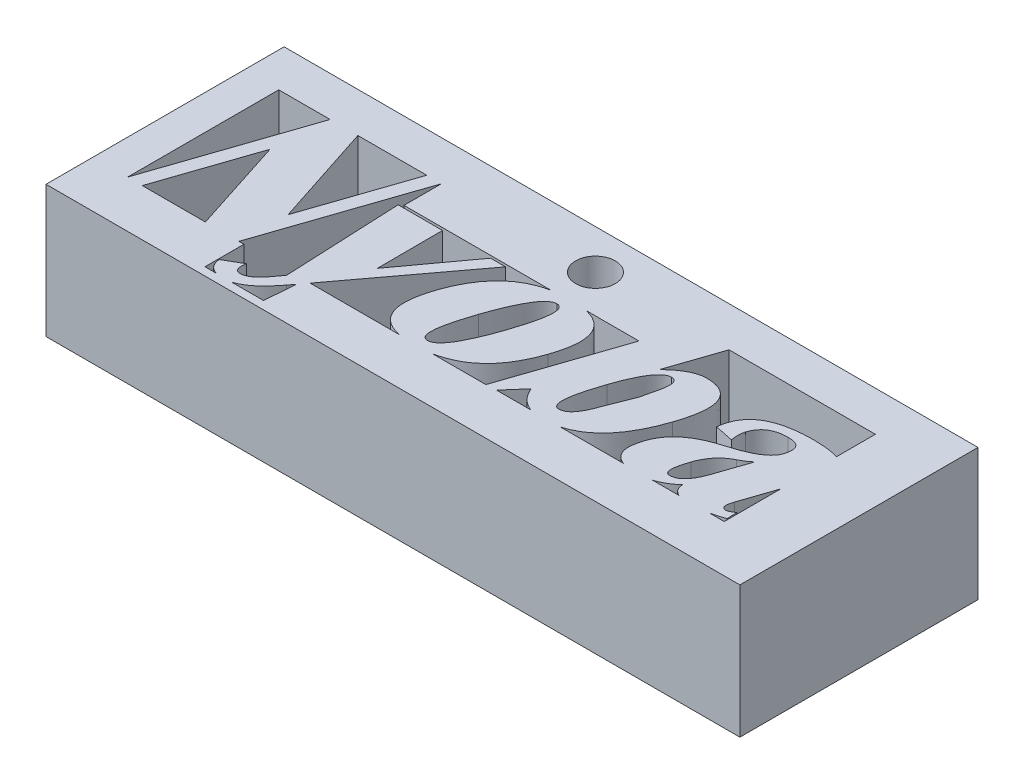
from build123d import *

# Parameters (mm, degrees)
BOSS_EXTRUDE1_DEPTH   = 10
BOSS_EXTRUDE1_2_DEPTH = 10
BOSS_EXTRUDE1_3_DEPTH = 10
BOSS_EXTRUDE1_4_DEPTH = 10
BOSS_EXTRUDE1_5_DEPTH = 10
BOSS_EXTRUDE5_DEPTH   = 10
SKETCH3_R             = 1.5
CUT_EXTRUDE1_DEPTH    = 10


with BuildPart() as part:
    # Sketch1 → Boss-Extrude1 (new body)
    with BuildSketch(Plane(origin=(0, 0, 0), x_dir=(1, 0, 0), z_dir=(0, 1, 0))):
        Polygon((13.285171, 11.459765625), (9.390641276, 0), (6.851487478, 0), (4.526209513, 7.22950058), (2.069124349, 0), (0.954980469, 0), (4.849510193, 11.459765625), (6.953451538, 11.459765625), (9.505039978, 3.615993754), (12.17102712, 11.459765625), align=None)
    extrude(amount=BOSS_EXTRUDE1_DEPTH)



with BuildPart() as body_2:
    # Sketch1 → Boss-Extrude1 2 (new body)
    with BuildSketch(Plane(origin=(0, 0, 0), x_dir=(1, 0, 0), z_dir=(0, 1, 0))):
        with BuildLine():
            Line((21.171220652, 8.435660807), (14.063579559, -1.069379171))
            add(Edge.make_bspline(
                [(14.063579559, -1.069379171), (13.944585095, -1.223575116), (13.716200832, -1.519521042), (13.355468809, -1.918598575), (12.997813379, -2.256674631), (12.643364074, -2.532918446), (12.292935081, -2.751837882), (11.943553034, -2.907427957), (11.596151624, -3.006426524), (11.364203668, -3.018301957), (11.250863647, -3.024104818)],
                knots=[0, 0, 0, 0, 1.318994485, 2.531526009, 3.639931488, 4.648586661, 5.571228885, 6.431032907, 7.233333353, 8, 8, 8, 8], degree=3))
            add(Edge.make_bspline(
                [(11.250863647, -3.024104818), (11.14784498, -3.020948248), (10.952904155, -3.014975114), (10.678503703, -2.965943828), (10.440166122, -2.88330152), (10.241347168, -2.760571884), (10.076626108, -2.607111034), (9.956540939, -2.414421713), (9.872061224, -2.190324674), (9.849904575, -2.027602414), (9.838288371, -1.942291005)],
                knots=[0, 0, 0, 0, 1.239523161, 2.345532834, 3.343160013, 4.257212786, 5.139605911, 6.028297907, 6.966283515, 8, 8, 8, 8], degree=3))
            Line((9.838288371, -1.942291005), (11.156360372, -1.17383016))
            add(Edge.make_bspline(
                [(11.156360372, -1.17383016), (11.144222307, -1.24327393), (11.121644149, -1.372447109), (11.109869304, -1.555262436), (11.122701432, -1.712103212), (11.16128016, -1.841979159), (11.225083509, -1.945792927), (11.317409458, -2.018673834), (11.433962461, -2.061477383), (11.519073609, -2.066474092), (11.564216614, -2.069124349)],
                knots=[0, 0, 0, 0, 1.454753201, 2.706003661, 3.772074978, 4.68687363, 5.479713085, 6.246827889, 7.070116434, 8, 8, 8, 8], degree=3))
            add(Edge.make_bspline(
                [(11.564216614, -2.069124349), (11.620100764, -2.065400664), (11.735581767, -2.057705909), (11.908430758, -2.004291301), (12.085915303, -1.921046953), (12.262719589, -1.798915491), (12.446500445, -1.649108824), (12.629019414, -1.462237524), (12.819550167, -1.246256651), (12.939071092, -1.08446918), (13.001661174, -0.999745178)],
                knots=[0, 0, 0, 0, 0.723576921, 1.495225197, 2.32647129, 3.255941294, 4.270912851, 5.394997918, 6.635826388, 8, 8, 8, 8], degree=3))
            Line((13.001661174, -0.999745178), (13.426925913, -0.420290883))
            Line((13.426925913, -0.420290883), (13.029017385, 8.435660807))
            Line((13.029017385, 8.435660807), (16.39383138, 8.435660807))
            Line((16.39383138, 8.435660807), (16.411239878, 3.474238841))
            Line((16.411239878, 3.474238841), (20.037181346, 8.435660807))
            Line((20.037181346, 8.435660807), (21.171220652, 8.435660807))
        make_face()
    extrude(amount=BOSS_EXTRUDE1_2_DEPTH)


with BuildPart() as body_3:
    # Sketch1 → Boss-Extrude1 3 (new body)
    with BuildSketch(Plane(origin=(0, 0, 0), x_dir=(1, 0, 0), z_dir=(0, 1, 0))):
        with BuildLine():
            add(Edge.make_bspline(
                [(25.819289653, 8.75398763), (25.987714429, 8.750933082), (26.310523729, 8.74507862), (26.771747319, 8.693187054), (27.188601337, 8.607184245), (27.561767138, 8.486673197), (27.891369278, 8.329880389), (28.176875534, 8.138134944), (28.414618908, 7.907264046), (28.60911591, 7.643045672), (28.756885343, 7.342300492), (28.858626831, 7.007215683), (28.914232479, 6.638066139), (28.925810252, 6.234865584), (28.887269196, 5.798015962), (28.809239481, 5.326673623), (28.686604439, 4.820578776), (28.575492276, 4.476608283), (28.517606862, 4.297412109)],
                knots=[0, 0, 0, 0, 1.229247068, 2.356021443, 3.382708377, 4.331935857, 5.211636368, 6.039164321, 6.8309341, 7.618924968, 8.422745332, 9.265012565, 10.165451544, 11.140262277, 12.202712173, 13.361787333, 14.625586715, 16, 16, 16, 16], degree=3))
            add(Edge.make_bspline(
                [(28.517606862, 4.297412109), (28.45351733, 4.116669773), (28.328005191, 3.762706238), (28.105802889, 3.25681793), (27.861242428, 2.787052257), (27.601641014, 2.347822068), (27.313841604, 1.948754053), (27.010917453, 1.578682939), (26.681273038, 1.249280477), (26.334580083, 0.95010375), (25.964765949, 0.688002055), (25.573195287, 0.461469795), (25.160625961, 0.268674102), (24.726740719, 0.112363787), (24.272501677, -0.00970624), (23.797608217, -0.096242314), (23.301258468, -0.14966953), (22.962774779, -0.155957642), (22.790210978, -0.159163411)],
                knots=[0, 0, 0, 0, 1.175065552, 2.301233694, 3.382913599, 4.419814754, 5.425063526, 6.395650903, 7.347709817, 8.277394233, 9.199369194, 10.121358154, 11.046477625, 11.986695364, 12.944323502, 13.925912684, 14.942600774, 16, 16, 16, 16], degree=3))
            add(Edge.make_bspline(
                [(22.790210978, -0.159163411), (22.621776627, -0.156153752), (22.298948977, -0.150385326), (21.836235766, -0.097723237), (21.417403501, -0.013153176), (21.042814833, 0.108260851), (20.71301466, 0.264782143), (20.427634055, 0.457528581), (20.187367342, 0.686649743), (19.993038121, 0.951894663), (19.84511143, 1.252491579), (19.743468743, 1.587614643), (19.687611571, 1.956770074), (19.677047133, 2.359832717), (19.711289454, 2.796948475), (19.790618432, 3.268127139), (19.912861416, 3.774252139), (20.02403082, 4.118218229), (20.081946055, 4.297412109)],
                knots=[0, 0, 0, 0, 1.228038986, 2.353705987, 3.391218502, 4.339513098, 5.218349054, 6.045063728, 6.840410309, 7.627626754, 8.430657137, 9.272096605, 10.171650648, 11.145503354, 12.206444081, 13.364380122, 14.626937465, 16, 16, 16, 16], degree=3))
            add(Edge.make_bspline(
                [(20.081946055, 4.297412109), (20.146011962, 4.478169568), (20.271477832, 4.832162718), (20.494011727, 5.337838783), (20.73758412, 5.808743214), (21.001368184, 6.245236923), (21.284871047, 6.648002895), (21.591647563, 7.014187961), (21.918219088, 7.347309182), (22.267725548, 7.644596811), (22.639338813, 7.906200308), (23.031284283, 8.133440896), (23.443925156, 8.326086208), (23.878489531, 8.482904534), (24.334556311, 8.604478377), (24.811095428, 8.690864321), (25.308238261, 8.744524177), (25.646724534, 8.750792136), (25.819289653, 8.75398763)],
                knots=[0, 0, 0, 0, 1.17379807, 2.298751473, 3.379264627, 4.417667667, 5.418890693, 6.391680266, 7.339143885, 8.271686748, 9.196811248, 10.117805706, 11.0419273, 11.981130875, 12.942627758, 13.928149894, 14.943741336, 16, 16, 16, 16], degree=3))
        make_face()
        with BuildLine():
            add(Edge.make_bspline(
                [(25.540753682, 7.958170573), (25.497357686, 7.954910296), (25.407817705, 7.94818329), (25.273951762, 7.90356534), (25.14128753, 7.828546778), (25.005635914, 7.72774268), (24.870046914, 7.596565012), (24.729774326, 7.439675177), (24.592257658, 7.251296646), (24.449330289, 7.03745884), (24.309401808, 6.792595015), (24.164335746, 6.520937306), (24.018977496, 6.219990197), (23.868658836, 5.891594233), (23.721076273, 5.533115483), (23.568893669, 5.146944042), (23.414682028, 4.732654231), (23.315965899, 4.445198113), (23.265214284, 4.297412109)],
                knots=[0, 0, 0, 0, 0.465798473, 0.96109295, 1.498705268, 2.096703288, 2.770241422, 3.520316646, 4.353229604, 5.271341494, 6.280187857, 7.378906499, 8.576821054, 9.867090618, 11.255275713, 12.73753087, 14.322709995, 16, 16, 16, 16], degree=3))
            add(Edge.make_bspline(
                [(23.265214284, 4.297412109), (23.215812116, 4.150018223), (23.120331088, 3.865145707), (22.990376609, 3.45097652), (22.881774599, 3.063873801), (22.785733677, 2.70731335), (22.710557657, 2.377871037), (22.654591553, 2.077296893), (22.608269554, 1.805941203), (22.590152335, 1.562071404), (22.583404387, 1.347064288), (22.593067124, 1.159723356), (22.626364882, 1.001358824), (22.670370555, 0.868255084), (22.739653915, 0.76488109), (22.826410147, 0.688793529), (22.934083261, 0.644689676), (23.01114871, 0.639408031), (23.05133845, 0.636653646)],
                knots=[0, 0, 0, 0, 1.867939927, 3.610222641, 5.215197755, 6.698700538, 8.047097408, 9.273972599, 10.372859214, 11.352294881, 12.209181684, 12.957923034, 13.598694019, 14.150165215, 14.630885378, 15.076025384, 15.51814594, 16, 16, 16, 16], degree=3))
            add(Edge.make_bspline(
                [(23.05133845, 0.636653646), (23.095589541, 0.639812799), (23.186017402, 0.646268582), (23.321124279, 0.691873659), (23.45540413, 0.765442552), (23.591369412, 0.867203482), (23.727009257, 0.998239868), (23.867421756, 1.155071067), (24.004484665, 1.344291631), (24.150828062, 1.556425684), (24.289531442, 1.803037912), (24.43820978, 2.073148151), (24.583358651, 2.374351059), (24.730276521, 2.703874665), (24.878698282, 3.061610972), (25.030593921, 3.447908992), (25.184888816, 3.862162081), (25.283593105, 4.149623421), (25.334338633, 4.297412109)],
                knots=[0, 0, 0, 0, 0.47398303, 0.968592427, 1.513273463, 2.110444346, 2.783050859, 3.532088596, 4.363849489, 5.285630575, 6.293081526, 7.394482706, 8.590740334, 9.875573513, 11.261838504, 12.74204344, 14.325029983, 16, 16, 16, 16], degree=3))
            add(Edge.make_bspline(
                [(25.334338633, 4.297412109), (25.383851491, 4.444774414), (25.479546452, 4.729585891), (25.608085813, 5.144396675), (25.721692994, 5.530092045), (25.813451105, 5.887873296), (25.887544759, 6.217343981), (25.950416963, 6.516664999), (25.986227244, 6.789560678), (26.010063559, 7.032502017), (26.017384744, 7.248015786), (26.002035258, 7.434545576), (25.974675358, 7.594258711), (25.926498359, 7.726949268), (25.854904404, 7.829294652), (25.768265694, 7.906114064), (25.659688333, 7.950435497), (25.58177844, 7.955502472), (25.540753682, 7.958170573)],
                knots=[0, 0, 0, 0, 1.865850032, 3.606183439, 5.212108544, 6.691444057, 8.03833231, 9.265731815, 10.360498967, 11.339698587, 12.195626685, 12.944258019, 13.5823757, 14.136723438, 14.622542498, 15.06718447, 15.508810371, 16, 16, 16, 16], degree=3))
        make_face(mode=Mode.SUBTRACT)
    extrude(amount=BOSS_EXTRUDE1_3_DEPTH)


with BuildPart() as body_4:
    # Sketch1 → Boss-Extrude1 4 (new body)
    with BuildSketch(Plane(origin=(0, 0, 0), x_dir=(1, 0, 0), z_dir=(0, 1, 0))):
        with BuildLine():
            Line((28.171923828, 0), (32.066453552, 11.459765625))
            add(Edge.make_bspline(
                [(32.066453552, 11.459765625), (32.136090434, 11.460390761), (32.292802768, 11.461797582), (32.553180429, 11.469282739), (32.863980195, 11.485348887), (33.224595963, 11.505086258), (33.634935154, 11.530136968), (34.095003051, 11.560210754), (34.605759647, 11.59443167), (34.962919535, 11.621920203), (35.150244649, 11.636337535)],
                knots=[0, 0, 0, 0, 0.541004987, 1.217489252, 2.023425992, 2.958657658, 4.023220479, 5.217138913, 6.540430244, 8, 8, 8, 8], degree=3))
            Line((35.150244649, 11.636337535), (33.757564799, 7.540366618))
            add(Edge.make_bspline(
                [(33.757564799, 7.540366618), (33.861922473, 7.63589343), (34.063690028, 7.820587189), (34.370124929, 8.070830642), (34.673838676, 8.277300894), (34.966458674, 8.452738951), (35.256973232, 8.583647312), (35.537765292, 8.684449269), (35.814541486, 8.740348359), (35.996414861, 8.749509099), (36.085329692, 8.75398763)],
                knots=[0, 0, 0, 0, 1.264227509, 2.444286863, 3.531248669, 4.54385076, 5.488605986, 6.374146394, 7.205147542, 8, 8, 8, 8], degree=3))
            add(Edge.make_bspline(
                [(36.085329692, 8.75398763), (36.205666099, 8.750440349), (36.435729983, 8.743658517), (36.763644744, 8.69844916), (37.056374931, 8.615800709), (37.315470703, 8.50192193), (37.541721069, 8.353961489), (37.73000419, 8.169507898), (37.884765167, 7.953269178), (38.004903031, 7.704602238), (38.085276104, 7.422710944), (38.131956309, 7.110194033), (38.142653476, 6.764960906), (38.117988511, 6.387532479), (38.06330265, 5.976660075), (37.968328122, 5.535734294), (37.844824893, 5.060193307), (37.737766314, 4.737016671), (37.681937663, 4.568487295)],
                knots=[0, 0, 0, 0, 1.04276418, 1.993597636, 2.859899959, 3.670191886, 4.43720561, 5.188999834, 5.94051948, 6.730824996, 7.569528261, 8.470629504, 9.462549342, 10.556294558, 11.744877076, 13.050801542, 14.46205906, 16, 16, 16, 16], degree=3))
            add(Edge.make_bspline(
                [(37.681937663, 4.568487295), (37.614051057, 4.377163167), (37.481288516, 4.002999855), (37.257682118, 3.466568061), (37.018812731, 2.966247368), (36.763262799, 2.504884483), (36.494240793, 2.07840608), (36.207544351, 1.690106072), (35.907895199, 1.335824324), (35.590646705, 1.019632252), (35.255800192, 0.744345664), (34.910119486, 0.499128444), (34.544097654, 0.298524923), (34.165285626, 0.130335361), (33.769611581, -8.1965e-05), (33.358645776, -0.089964265), (32.93290082, -0.151078697), (32.643640675, -0.15643986), (32.496692149, -0.159163411)],
                knots=[0, 0, 0, 0, 1.290986424, 2.524719497, 3.694376449, 4.815358314, 5.877239036, 6.899057916, 7.882675239, 8.825897986, 9.743304395, 10.636966131, 11.517261398, 12.393061135, 13.270050311, 14.161594361, 15.066062145, 16, 16, 16, 16], degree=3))
            add(Edge.make_bspline(
                [(32.496692149, -0.159163411), (32.361220487, -0.15454901), (32.099011418, -0.14561771), (31.72105368, -0.072104679), (31.374200795, 0.048473718), (31.061275107, 0.223988912), (30.779489447, 0.444853987), (30.530938633, 0.715485585), (30.314184838, 1.034698059), (30.20367204, 1.273968277), (30.146544902, 1.397653707)],
                knots=[0, 0, 0, 0, 1.079581468, 2.089559167, 3.05764771, 3.995748367, 4.937359693, 5.901036756, 6.91498753, 8, 8, 8, 8], degree=3))
            Line((30.146544902, 1.397653707), (28.925463104, 0))
            Line((28.925463104, 0), (28.171923828, 0))
        make_face()
        with BuildLine():
            add(Edge.make_bspline(
                [(34.720006053, 7.480680339), (34.679241017, 7.477717952), (34.595718046, 7.471648356), (34.470204849, 7.439443258), (34.346970132, 7.378690869), (34.221474278, 7.300101368), (34.101211599, 7.191950648), (33.974651885, 7.068917971), (33.854584346, 6.916717919), (33.729873875, 6.745729185), (33.60562772, 6.551674764), (33.484122158, 6.333042404), (33.360704512, 6.093263533), (33.235599126, 5.830667807), (33.111504911, 5.545531654), (32.990518326, 5.23519784), (32.866207421, 4.903839664), (32.786341178, 4.67394494), (32.745384979, 4.556052653)],
                knots=[0, 0, 0, 0, 0.531561073, 1.08910881, 1.673281945, 2.313939159, 3.010429782, 3.773549671, 4.609575287, 5.529190165, 6.529081087, 7.606675547, 8.78440468, 10.039499126, 11.392827221, 12.831748407, 14.375289259, 16, 16, 16, 16], degree=3))
            add(Edge.make_bspline(
                [(32.745384979, 4.556052653), (32.698218901, 4.417026331), (32.607580901, 4.149862547), (32.488392466, 3.759557473), (32.384103598, 3.397205314), (32.293058116, 3.061129042), (32.2214433, 2.7516245), (32.165051394, 2.469008998), (32.128244427, 2.213186056), (32.10431512, 1.984312274), (32.097718748, 1.78202201), (32.110767812, 1.606633186), (32.133562829, 1.45577722), (32.183396692, 1.334519372), (32.241245396, 1.233639147), (32.325105492, 1.16546403), (32.423407772, 1.118699635), (32.496116074, 1.115704371), (32.533996073, 1.11414388)],
                knots=[0, 0, 0, 0, 1.877099092, 3.607179479, 5.217517603, 6.698501046, 8.058671159, 9.278942107, 10.382242031, 11.362082124, 12.220930577, 12.964809562, 13.611399598, 14.158601728, 14.635005133, 15.078808028, 15.520071984, 16, 16, 16, 16], degree=3))
            add(Edge.make_bspline(
                [(32.533996073, 1.11414388), (32.602779308, 1.119578696), (32.743508729, 1.130698243), (32.946027834, 1.219685822), (33.138729587, 1.358455992), (33.3205528, 1.552499907), (33.494007327, 1.799462944), (33.659367475, 2.100431002), (33.817846247, 2.454317695), (33.910245202, 2.711704636), (33.959005992, 2.847532908)],
                knots=[0, 0, 0, 0, 0.692664402, 1.417180531, 2.197722036, 3.079979668, 4.08825708, 5.238900149, 6.542912008, 8, 8, 8, 8], degree=3))
            Line((33.959005992, 2.847532908), (34.777205404, 4.914170329))
            Line((34.777205404, 4.914170329), (35.048280589, 6.075565847))
            add(Edge.make_bspline(
                [(35.048280589, 6.075565847), (35.074446922, 6.184583775), (35.123067279, 6.387152873), (35.15994574, 6.673848596), (35.171305809, 6.917518646), (35.149578071, 7.119466346), (35.094707395, 7.281458469), (35.001363414, 7.399630475), (34.870191459, 7.470482237), (34.772311018, 7.477128653), (34.720006053, 7.480680339)],
                knots=[0, 0, 0, 0, 1.616096948, 3.002912534, 4.163390542, 5.127473154, 5.91823792, 6.598056841, 7.250835133, 8, 8, 8, 8], degree=3))
        make_face(mode=Mode.SUBTRACT)
    extrude(amount=BOSS_EXTRUDE1_4_DEPTH)


with BuildPart() as body_5:
    # Sketch1 → Boss-Extrude1 5 (new body)
    with BuildSketch(Plane(origin=(0, 0, 0), x_dir=(1, 0, 0), z_dir=(0, 1, 0))):
        with BuildLine():
            add(Edge.make_bspline(
                [(46.1026769, 0.303405253), (45.896432798, 0.23288838), (45.497174634, 0.096378113), (44.899746942, -0.047157294), (44.329091915, -0.140048966), (43.955954387, -0.152919005), (43.774912008, -0.159163411)],
                knots=[0, 0, 0, 0, 1.096438446, 2.122543122, 3.089077793, 4, 4, 4, 4], degree=3))
            add(Edge.make_bspline(
                [(43.774912008, -0.159163411), (43.652056536, -0.156913147), (43.421871648, -0.152696999), (43.099942921, -0.106330779), (42.826078685, -0.028662609), (42.597633781, 0.080159699), (42.418011706, 0.224659529), (42.285442403, 0.401619501), (42.206011411, 0.613970695), (42.194343202, 0.766123453), (42.18825175, 0.845555623)],
                knots=[0, 0, 0, 0, 1.394250094, 2.612299619, 3.681604072, 4.616137303, 5.465854739, 6.273499309, 7.098670974, 8, 8, 8, 8], degree=3))
            add(Edge.make_bspline(
                [(42.18825175, 0.845555623), (42.096916581, 0.764923687), (41.916727523, 0.605850322), (41.624395483, 0.403204014), (41.324123354, 0.230068471), (41.014371822, 0.086269171), (40.692787938, -0.021861378), (40.361978391, -0.102952794), (40.021080445, -0.151121904), (39.790173984, -0.156471271), (39.673967234, -0.159163411)],
                knots=[0, 0, 0, 0, 1.05354736, 2.078473278, 3.071470751, 4.05048091, 5.028228712, 6.002575825, 6.994769703, 8, 8, 8, 8], degree=3))
            add(Edge.make_bspline(
                [(39.673967234, -0.159163411), (39.56860518, -0.157451377), (39.365716455, -0.154154625), (39.075658001, -0.123797464), (38.811599184, -0.077640066), (38.574962617, -0.012033425), (38.365258732, 0.075872409), (38.181822637, 0.182433846), (38.025767288, 0.309549674), (37.898772929, 0.457420937), (37.797754602, 0.623369399), (37.725465188, 0.81031883), (37.681188097, 1.01668736), (37.664827022, 1.241618715), (37.67590621, 1.485093693), (37.714667278, 1.747100341), (37.77962433, 2.029022686), (37.841265858, 2.220427035), (37.873431142, 2.320304108)],
                knots=[0, 0, 0, 0, 1.304620715, 2.512221632, 3.607818634, 4.621862217, 5.546736593, 6.416631869, 7.240915559, 8.027168397, 8.819564973, 9.635622329, 10.497604322, 11.424471289, 12.421266459, 13.510300629, 14.700845172, 16, 16, 16, 16], degree=3))
            add(Edge.make_bspline(
                [(37.873431142, 2.320304108), (37.901069235, 2.397962432), (37.956079629, 2.552532254), (38.062981953, 2.774040182), (38.181831725, 2.989320466), (38.318870884, 3.19506343), (38.470850198, 3.392101647), (38.638831505, 3.579829924), (38.822474219, 3.758500452), (39.022784193, 3.927603829), (39.236264718, 4.089735332), (39.466874238, 4.24165734), (39.712883964, 4.386307458), (39.976563962, 4.519893258), (40.255957162, 4.64393621), (40.549783261, 4.760453108), (40.858508994, 4.871417655), (41.072102985, 4.93431518), (41.181045787, 4.966395823)],
                knots=[0, 0, 0, 0, 0.895932749, 1.783249465, 2.671253047, 3.568998693, 4.468914995, 5.375670759, 6.306580238, 7.253249886, 8.225214829, 9.220486441, 10.255007372, 11.327607293, 12.433493681, 13.578707072, 14.765028765, 16, 16, 16, 16], degree=3))
            add(Edge.make_bspline(
                [(41.181045787, 4.966395823), (41.374882617, 5.024840013), (41.743030599, 5.135841161), (42.256670283, 5.325806803), (42.707210243, 5.518811311), (43.089140544, 5.727388377), (43.407008405, 5.943121505), (43.659728767, 6.167634136), (43.854429759, 6.401561275), (43.928607596, 6.576647499), (43.963918559, 6.659993998)],
                knots=[0, 0, 0, 0, 1.44603237, 2.746402208, 3.910564404, 4.944253428, 5.851059526, 6.647821504, 7.356320889, 8, 8, 8, 8], degree=3))
            add(Edge.make_bspline(
                [(43.963918559, 6.659993998), (43.99416091, 6.760341091), (44.049929889, 6.94538804), (44.086510964, 7.213696632), (44.057683488, 7.445200573), (43.975569283, 7.641406888), (43.826240776, 7.789488462), (43.622552334, 7.889423545), (43.367991202, 7.949898362), (43.180086131, 7.955269086), (43.078572083, 7.958170573)],
                knots=[0, 0, 0, 0, 1.26721943, 2.336839907, 3.247230097, 4.059641373, 4.860837845, 5.730853818, 6.774113896, 8, 8, 8, 8], degree=3))
            add(Edge.make_bspline(
                [(43.078572083, 7.958170573), (42.955616289, 7.954760405), (42.720545534, 7.948240738), (42.38478127, 7.887715192), (42.083830524, 7.788604262), (41.814457267, 7.651592193), (41.581991207, 7.469399203), (41.387160278, 7.246075136), (41.220056572, 6.987072484), (41.146764872, 6.791044865), (41.108924866, 6.689837138)],
                knots=[0, 0, 0, 0, 1.167645444, 2.23234131, 3.228837679, 4.169623404, 5.089967512, 6.016360831, 6.975860583, 8, 8, 8, 8], degree=3))
            add(Edge.make_bspline(
                [(41.108924866, 6.689837138), (41.089097176, 6.618994279), (41.047023803, 6.468669253), (41.032021909, 6.218941194), (41.045110397, 5.939098609), (41.075451775, 5.743771558), (41.091516368, 5.640353394)],
                knots=[0, 0, 0, 0, 0.831019779, 1.763382674, 2.815797118, 4, 4, 4, 4], degree=3))
            Line((41.091516368, 5.640353394), (39.671480306, 5.933810933))
            add(Edge.make_bspline(
                [(39.671480306, 5.933810933), (39.689691274, 6.064689717), (39.725335821, 6.320860325), (39.799395391, 6.568646231), (39.835617574, 6.689837138)],
                knots=[0, 0, 0, 0, 1.02180952, 2, 2, 2, 2], degree=3))
            add(Edge.make_bspline(
                [(39.835617574, 6.689837138), (39.86701501, 6.774309568), (39.929050416, 6.941211138), (40.052202942, 7.176840206), (40.200505251, 7.394248758), (40.3706297, 7.59652297), (40.562650227, 7.784693476), (40.779975695, 7.952825408), (41.019909765, 8.106236259), (41.281374515, 8.2448214), (41.568388907, 8.364093348), (41.877603829, 8.468258572), (42.209804176, 8.557384655), (42.565485102, 8.628792017), (42.943005831, 8.686361325), (43.344881981, 8.724565826), (43.769590046, 8.750713041), (44.060866195, 8.752878161), (44.210124461, 8.75398763)],
                knots=[0, 0, 0, 0, 0.835094197, 1.649988442, 2.458073729, 3.271080298, 4.09738884, 4.946239611, 5.81412628, 6.735709725, 7.686581105, 8.693006228, 9.759636701, 10.873770639, 12.055547515, 13.29930583, 14.616086723, 16, 16, 16, 16], degree=3))
            add(Edge.make_bspline(
                [(44.210124461, 8.75398763), (44.350239473, 8.752555425), (44.619886075, 8.749799195), (45.007700115, 8.728965373), (45.36251785, 8.687483623), (45.686489873, 8.638576324), (45.977458634, 8.56741499), (46.238106508, 8.488684616), (46.464096389, 8.387416027), (46.660071045, 8.275236531), (46.821721615, 8.143275437), (46.955405578, 7.999082658), (47.049213758, 7.833761981), (47.117435537, 7.656512551), (47.145433588, 7.462527066), (47.14089572, 7.254998964), (47.109671031, 7.031821933), (47.062466892, 6.882424886), (47.037761943, 6.80423584)],
                knots=[0, 0, 0, 0, 1.612375176, 3.102961509, 4.466096455, 5.722265399, 6.869864671, 7.910684801, 8.850184943, 9.713994311, 10.500615135, 11.24369205, 11.961923158, 12.67423861, 13.417621608, 14.199892422, 15.057888384, 16, 16, 16, 16], degree=3))
            Line((47.037761943, 6.80423584), (45.29691213, 1.681163534))
            add(Edge.make_bspline(
                [(45.29691213, 1.681163534), (45.274837749, 1.612716199), (45.23378513, 1.485421925), (45.196471687, 1.304678684), (45.179795995, 1.150493838), (45.194261369, 1.023402443), (45.229537397, 0.919426397), (45.29914011, 0.843246197), (45.398020412, 0.804139921), (45.469861956, 0.798718049), (45.508301036, 0.795817057)],
                knots=[0, 0, 0, 0, 1.577969068, 2.934612848, 4.048770832, 4.965492539, 5.726142785, 6.421710344, 7.155530393, 8, 8, 8, 8], degree=3))
            add(Edge.make_bspline(
                [(45.508301036, 0.795817057), (45.540153774, 0.80034743), (45.61747353, 0.811344518), (45.742182023, 0.870083125), (45.898816327, 0.955237643), (46.008850668, 1.030053112), (46.070346832, 1.071866099)],
                knots=[0, 0, 0, 0, 0.608272766, 1.476529326, 2.589678762, 4, 4, 4, 4], degree=3))
            Line((46.070346832, 1.071866099), (46.1026769, 0.303405253))
        make_face()
        with BuildLine():
            add(Edge.make_bspline(
                [(43.424255117, 5.070846812), (43.2920952, 4.965175823), (43.029422768, 4.755151058), (42.731633942, 4.598880764), (42.58367335, 4.521235657)],
                knots=[0, 0, 0, 0, 1.006271696, 2, 2, 2, 2], degree=3))
            add(Edge.make_bspline(
                [(42.58367335, 4.521235657), (42.492203045, 4.472543052), (42.311343936, 4.376265892), (42.060682766, 4.199616131), (41.831673004, 3.999595739), (41.619922781, 3.77761273), (41.435037166, 3.527940739), (41.269536144, 3.256619982), (41.123582869, 2.962601306), (41.048015667, 2.75304494), (41.009447734, 2.646091715)],
                knots=[0, 0, 0, 0, 0.988015722, 1.953548124, 2.917913406, 3.885937426, 4.874681131, 5.875844555, 6.915875102, 8, 8, 8, 8], degree=3))
            add(Edge.make_bspline(
                [(41.009447734, 2.646091715), (40.966552191, 2.514728809), (40.887016738, 2.27116019), (40.797620266, 1.927832297), (40.747898767, 1.635588516), (40.73426873, 1.395523211), (40.755798152, 1.203915564), (40.822594995, 1.059806384), (40.939535793, 0.967836607), (41.032752733, 0.959399054), (41.081568654, 0.954980469)],
                knots=[0, 0, 0, 0, 1.734384893, 3.215837308, 4.449253675, 5.449068203, 6.22755132, 6.84649404, 7.395931074, 8, 8, 8, 8], degree=3))
            add(Edge.make_bspline(
                [(41.081568654, 0.954980469), (41.159373658, 0.960330155), (41.314974794, 0.971028916), (41.539391281, 1.056356088), (41.75017004, 1.19247144), (41.946984195, 1.383083673), (42.130616176, 1.626108797), (42.304730848, 1.919657654), (42.465548839, 2.266784004), (42.555942537, 2.520091136), (42.603568776, 2.6535525)],
                knots=[0, 0, 0, 0, 0.76715715, 1.534226819, 2.340952032, 3.233305082, 4.22624964, 5.343145173, 6.600167843, 8, 8, 8, 8], degree=3))
            Line((42.603568776, 2.6535525), (43.424255117, 5.070846812))
        make_face(mode=Mode.SUBTRACT)
    extrude(amount=BOSS_EXTRUDE1_5_DEPTH)


with BuildPart() as part_1:
    add(part.part)

    add(body_2.part)  # Boss-Extrude5 merges body 2

    add(body_3.part)  # Boss-Extrude5 merges body 3

    add(body_4.part)  # Boss-Extrude5 merges body 4

    add(body_5.part)  # Boss-Extrude5 merges body 5
    # Sketch2 → Boss-Extrude5 (add)
    with BuildSketch(Plane(origin=(0, 10, 0), x_dir=(1, 0, 0), z_dir=(0, 1, 0))):
        Polygon((-1.667508681, 14.487482608), (-1.667508681, -3.563650035), (9.772460487, -3.563650035), (14.400568415, -3.563650035), (50.935848066, -3.563650035), (50.935848066, 14.487482608), align=None)
        Polygon((9.772460487, -2.950939465), (9.772460487, 0), (9.390641276, 0), (6.851487478, 0), (2.069124349, 0), (0.954980469, 0), (0.954980469, 11.459765625), (4.849510193, 11.459765625), (6.953451538, 11.459765625), (12.17102712, 11.459765625), (13.285171, 11.459765625), (13.285171, 8.621112413), (31.101755, 8.621112413), (32.066453552, 11.459765625), (46.182723527, 11.459765625), (46.182723527, 0), (28.171923828, 0), (28.157835098, -0.041456493), (14.832235502, -0.041456493), (14.400568415, -0.618724375), (14.207061592, -2.950939465), align=None, mode=Mode.SUBTRACT)
    extrude(amount=-BOSS_EXTRUDE5_DEPTH)

    # Sketch3 → Cut-Extrude1 (cut)
    with BuildSketch(Plane(origin=(0, 10, 0), x_dir=(1, 0, 0), z_dir=(0, 1, 0))):
        with Locations(Location((24.935848066, 11.487482608, 0), (0, 0, 270))):
            Circle(SKETCH3_R)
    extrude(amount=-CUT_EXTRUDE1_DEPTH, mode=Mode.SUBTRACT)


solid = part_1.part
